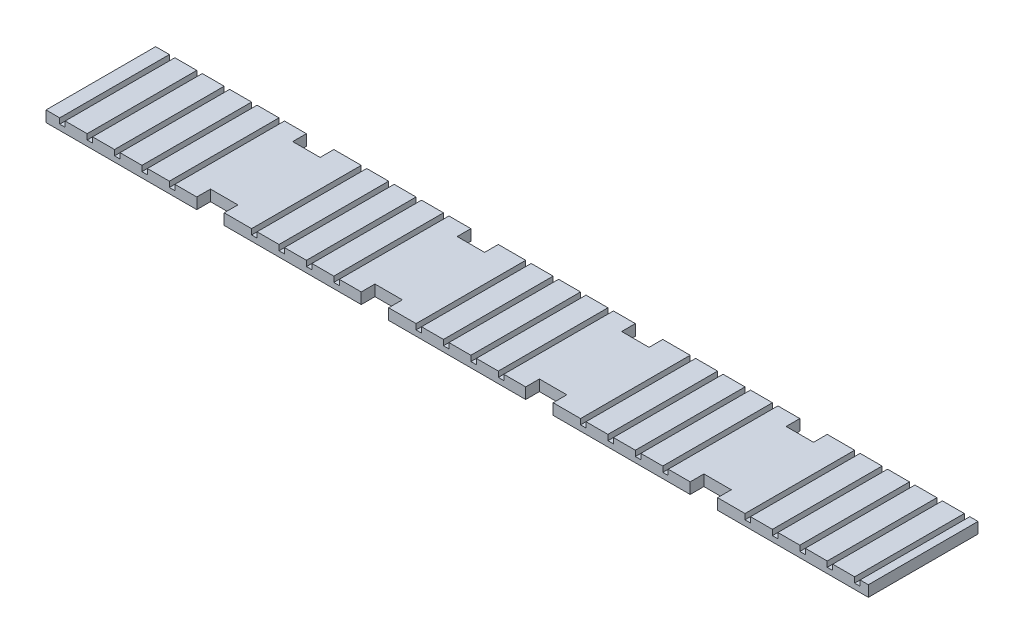
from build123d import *

# Parameters (mm, degrees)
BOSS_EXTRUDE1_DEPTH = 2
SKETCH2_W           = 1
SKETCH2_H           = 20
CUT_EXTRUDE1_DEPTH  = 1


with BuildPart() as part:
    # Sketch1 → Boss-Extrude1 (new body)
    with BuildSketch(Plane(origin=(0, 0, 0), x_dir=(1, 0, 0), z_dir=(0, 1, 0))):
        Polygon((122.5, 2.5), (122.5, 0), (150, 0), (150, 20), (122.5, 20), (122.5, 17.5), (117.5, 17.5), (117.5, 20), (92.5, 20), (92.5, 17.5), (87.5, 17.5), (87.5, 20), (62.5, 20), (62.5, 17.5), (57.5, 17.5), (57.5, 20), (32.5, 20), (32.5, 17.5), (27.5, 17.5), (27.5, 20), (0, 20), (0, 0), (27.5, 0), (27.5, 2.5), (32.5, 2.5), (32.5, 0), (57.5, 0), (57.5, 2.5), (62.5, 2.5), (62.5, 0), (87.5, 0), (87.5, 2.5), (92.5, 2.5), (92.5, 0), (117.5, 0), (117.5, 2.5), align=None)
    extrude(amount=BOSS_EXTRUDE1_DEPTH)

    # Sketch2 → Cut-Extrude1 (cut)
    with BuildSketch(Plane(origin=(0, 2, 0), x_dir=(1, 0, 0), z_dir=(0, 1, 0))):
        with Locations((3, 10)):
            Rectangle(SKETCH2_W, SKETCH2_H)
        with Locations((8, 10)):
            Rectangle(SKETCH2_W, SKETCH2_H)
        with Locations((13, 10)):
            Rectangle(SKETCH2_W, SKETCH2_H)
        with Locations((18, 10)):
            Rectangle(SKETCH2_W, SKETCH2_H)
        with Locations((23, 10)):
            Rectangle(SKETCH2_W, SKETCH2_H)
        with Locations((38, 10)):
            Rectangle(SKETCH2_W, SKETCH2_H)
        with Locations((43, 10)):
            Rectangle(SKETCH2_W, SKETCH2_H)
        with Locations((48, 10)):
            Rectangle(SKETCH2_W, SKETCH2_H)
        with Locations((53, 10)):
            Rectangle(SKETCH2_W, SKETCH2_H)
        with Locations((68, 10)):
            Rectangle(SKETCH2_W, SKETCH2_H)
        with Locations((73, 10)):
            Rectangle(SKETCH2_W, SKETCH2_H)
        with Locations((78, 10)):
            Rectangle(SKETCH2_W, SKETCH2_H)
        with Locations((83, 10)):
            Rectangle(SKETCH2_W, SKETCH2_H)
        with Locations((98, 10)):
            Rectangle(SKETCH2_W, SKETCH2_H)
        with Locations((103, 10)):
            Rectangle(SKETCH2_W, SKETCH2_H)
        with Locations((108, 10)):
            Rectangle(SKETCH2_W, SKETCH2_H)
        with Locations((113, 10)):
            Rectangle(SKETCH2_W, SKETCH2_H)
        with Locations((128, 10)):
            Rectangle(SKETCH2_W, SKETCH2_H)
        with Locations((133, 10)):
            Rectangle(SKETCH2_W, SKETCH2_H)
        with Locations((138, 10)):
            Rectangle(SKETCH2_W, SKETCH2_H)
        with Locations((143, 10)):
            Rectangle(SKETCH2_W, SKETCH2_H)
        with Locations((148, 10)):
            Rectangle(SKETCH2_W, SKETCH2_H)
    extrude(amount=-CUT_EXTRUDE1_DEPTH, mode=Mode.SUBTRACT)


solid = part.part
